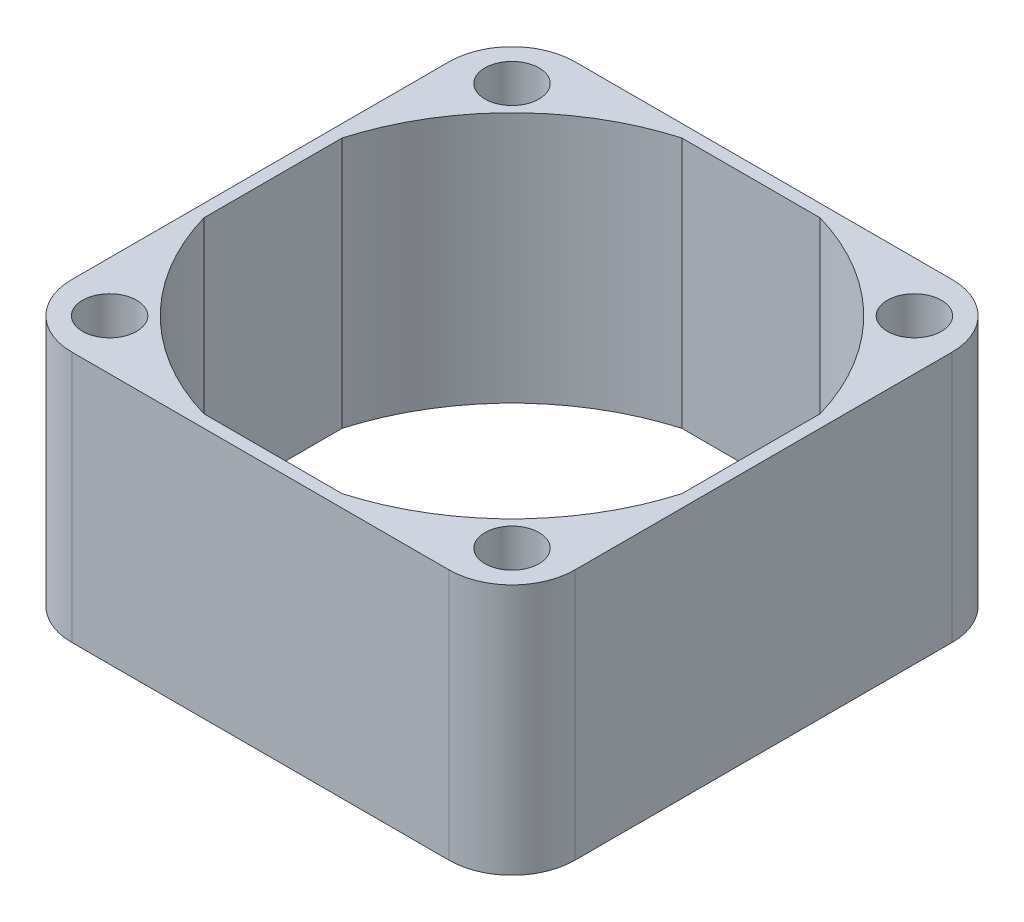
from build123d import *

# Parameters (mm, degrees)
SKETCH1_W           = 40
SKETCH1_H           = 40
SKETCH1_R           = 2.15
BOSS_EXTRUDE1_DEPTH = 20
FILLET1_R           = 5


with BuildPart() as part:
    # Sketch1 → Boss-Extrude1 (new body)
    with BuildSketch(Plane(origin=(0, 0, 0), x_dir=(1, 0, 0), z_dir=(0, 1, 0))):
        Rectangle(SKETCH1_W, SKETCH1_H)
        with Locations((16, 16)):
            Circle(SKETCH1_R, mode=Mode.SUBTRACT)
        with Locations((16, -16)):
            Circle(SKETCH1_R, mode=Mode.SUBTRACT)
        with Locations((-16, -16)):
            Circle(SKETCH1_R, mode=Mode.SUBTRACT)
        with Locations((-16, 16)):
            Circle(SKETCH1_R, mode=Mode.SUBTRACT)
        with BuildLine():
            Line((-5.5, 19), (5.5, 19))
            ThreePointArc((5.5, 19), (13.986600731, 13.986600731), (19, 5.5))
            Line((19, 5.5), (19, -5.5))
            ThreePointArc((19, -5.5), (13.986600731, -13.986600731), (5.5, -19))
            Line((5.5, -19), (-5.5, -19))
            ThreePointArc((-5.5, -19), (-13.986600731, -13.986600731), (-19, -5.5))
            Line((-19, -5.5), (-19, 5.5))
            ThreePointArc((-19, 5.5), (-13.986600731, 13.986600731), (-5.5, 19))
        make_face(mode=Mode.SUBTRACT)
    extrude(amount=BOSS_EXTRUDE1_DEPTH)

    # Fillet1
    fillet1_edges = [part.edges().sort_by_distance(p)[0] for p in [
        (-20, 10, 20),
        (20, 10, 20),
        (20, 10, -20),
        (-20, 10, -20),
    ]]
    fillet(fillet1_edges, radius=FILLET1_R)


solid = part.part
